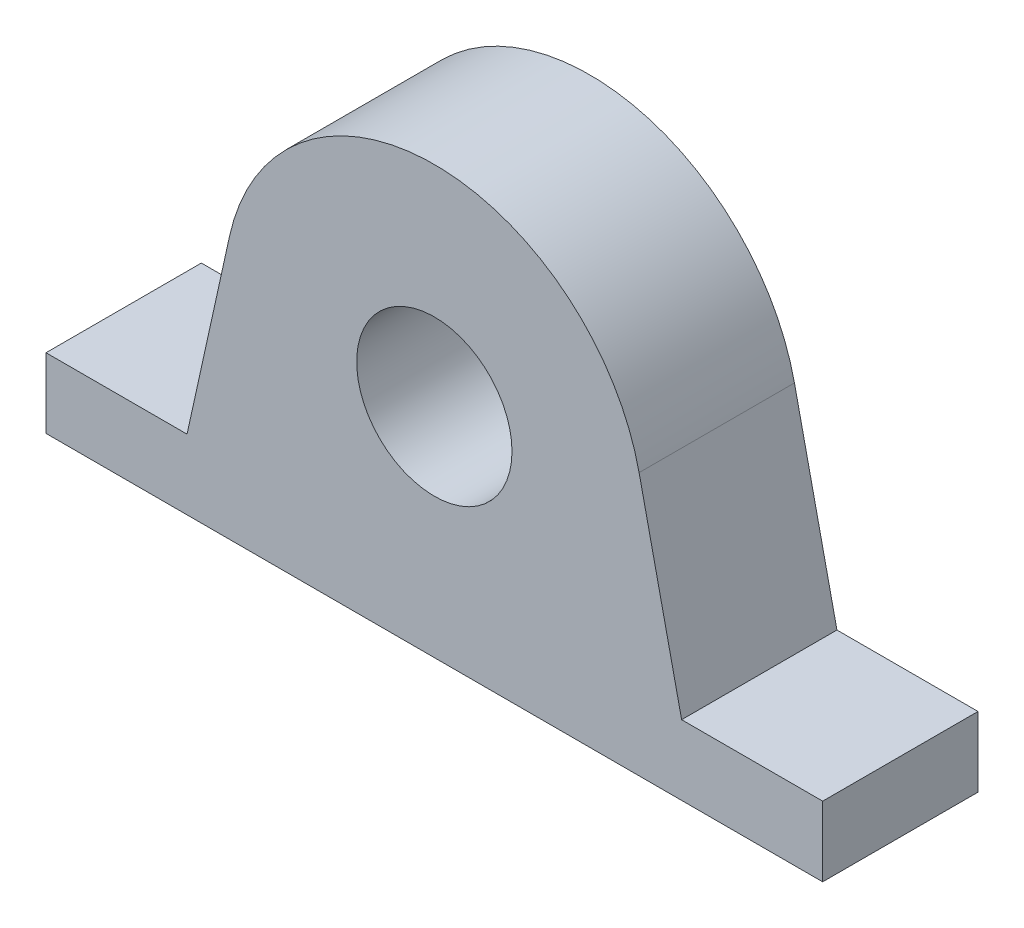
from build123d import *

# Parameters (mm, degrees)
SKIZZE1_R                       = 10
AUFSATZ_LINEAR_AUSTRAGEN1_DEPTH = 20


with BuildPart() as part:
    # Skizze1 → Aufsatz-Linear austragen1 (new body)
    with BuildSketch(Plane.XY):
        with BuildLine():
            Line((50, 0), (-50, 0))
            Line((-50, 0), (-50, 9))
            Line((-50, 9), (-31.839791753, 9))
            Line((-31.839791753, 9), (-26.366249418, 33.815573199))
            ThreePointArc((-26.366249418, 33.815573199), (0, 55), (26.366249418, 33.815573199))
            Line((26.366249418, 33.815573199), (31.839791753, 9))
            Line((31.839791753, 9), (50, 9))
            Line((50, 9), (50, 0))
        make_face()
        with Locations((0, 28)):
            Circle(SKIZZE1_R, mode=Mode.SUBTRACT)
    extrude(amount=AUFSATZ_LINEAR_AUSTRAGEN1_DEPTH)


solid = part.part
